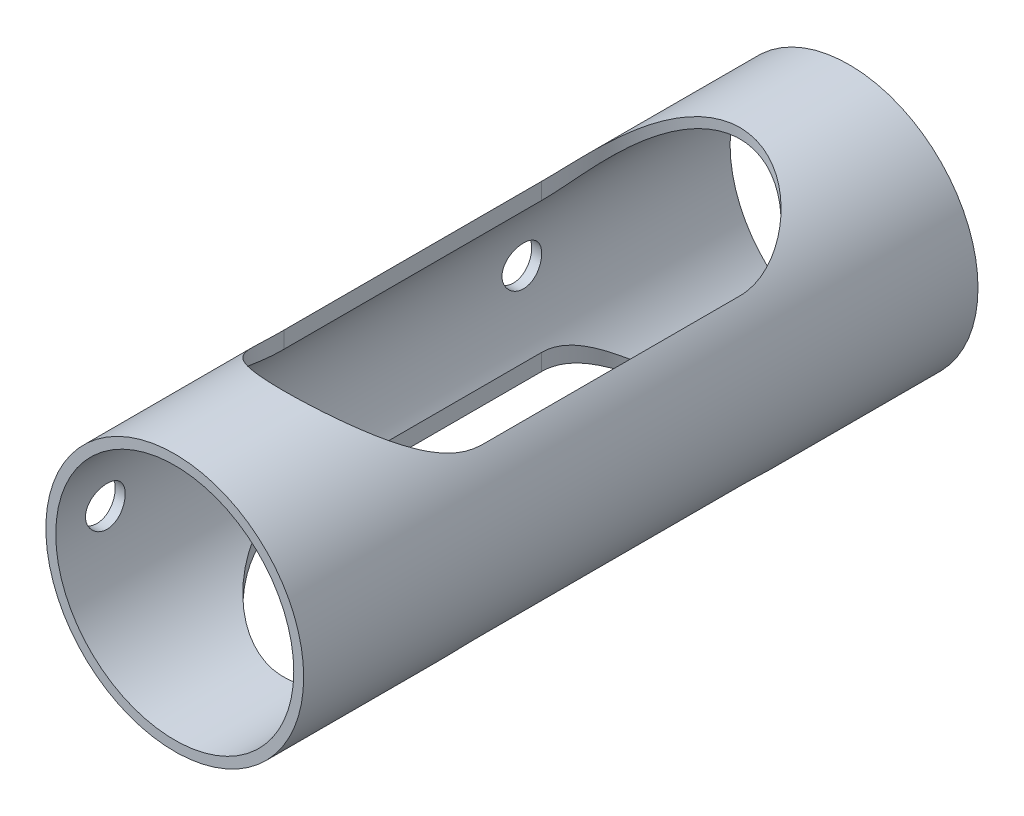
from build123d import *

# Parameters (mm, degrees)
SKETCH1_R           = 13
SKETCH1_R_2         = 12
BOSS_EXTRUDE1_DEPTH = 68
CUT_EXTRUDE1_DEPTH  = 34
SKETCH3_R           = 2
CUT_EXTRUDE2_DEPTH  = 68


with BuildPart() as part:
    # Sketch1 → Boss-Extrude1 (new body)
    with BuildSketch(Plane.XY):
        Circle(SKETCH1_R)
        Circle(SKETCH1_R_2, mode=Mode.SUBTRACT)
    extrude(amount=BOSS_EXTRUDE1_DEPTH)

    # Sketch2 → Cut-Extrude1 (cut, symmetric)
    with BuildSketch(Plane(origin=(0, 0, 0), x_dir=(1, 0, 0), z_dir=(0, 1, 0))):
        with BuildLine():
            Line((10, -21), (10, -47))
            ThreePointArc((10, -47), (0, -57), (-10, -47))
            Line((-10, -47), (-10, -21))
            ThreePointArc((-10, -21), (0, -11), (10, -21))
        make_face()
    extrude(amount=CUT_EXTRUDE1_DEPTH, both=True, mode=Mode.SUBTRACT)

    # Sketch3 → Cut-Extrude2 (cut)
    with BuildSketch(Plane(origin=(0, 0, 0), x_dir=(0, 0, -1), z_dir=(1, 0, 0))):
        with Locations(Location((-63, 0, 0), (0, 0, 180))):
            Circle(SKETCH3_R)
        with Locations(Location((-21, 0, 0), (0, 0, 180))):
            Circle(SKETCH3_R)
    extrude(amount=-CUT_EXTRUDE2_DEPTH, mode=Mode.SUBTRACT)


solid = part.part
